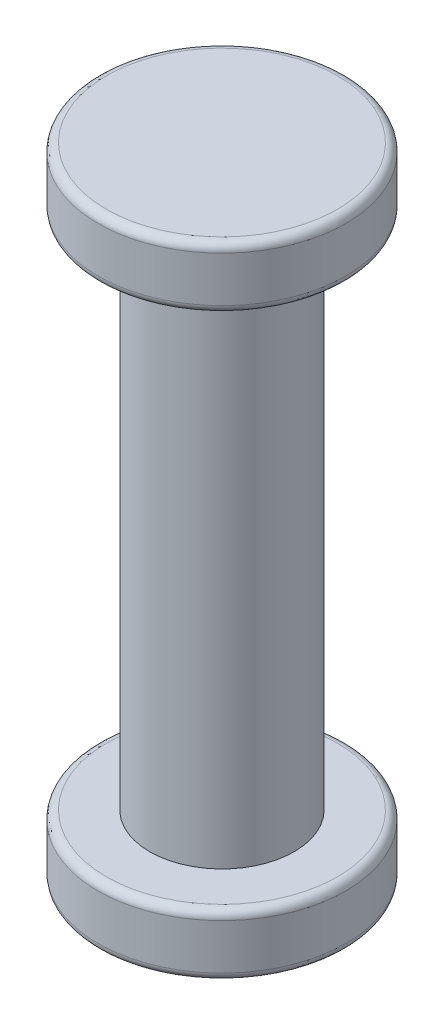
from build123d import *

# Parameters (mm, degrees)
SKETCH1_R           = 1.75
BOSS_EXTRUDE1_DEPTH = 6.25


with BuildPart() as part:
    # Sketch1 → Boss-Extrude1 (new, symmetric)
    with BuildSketch(Plane(origin=(0, 0, 0), x_dir=(1, 0, 0), z_dir=(0, 1, 0))):
        with Locations(Location((0, 0, 0), (0, 0, 270))):
            Circle(SKETCH1_R)
    extrude(amount=BOSS_EXTRUDE1_DEPTH, both=True)

    # Sketch2 → Revolve1 (revolve)
    with BuildSketch(Plane.XY, mode=Mode.PRIVATE) as revolve1_sk:
        with BuildLine():
            Line((-2.8, 6.25), (0, 6.25))
            Line((0, 6.25), (0, 7.75))
            Line((0, 7.75), (-2.8, 7.75))
            ThreePointArc((-2.8, 7.75), (-2.941421356, 7.691421356), (-3, 7.55))
            Line((-3, 7.55), (-3, 6.45))
            ThreePointArc((-3, 6.45), (-2.941421356, 6.308578644), (-2.8, 6.25))
        make_face()
        with BuildLine():
            Line((-2.8, -7.75), (0, -7.75))
            Line((0, -7.75), (0, -6.25))
            Line((0, -6.25), (-2.8, -6.25))
            ThreePointArc((-2.8, -6.25), (-2.941421356, -6.308578644), (-3, -6.45))
            Line((-3, -6.45), (-3, -7.55))
            ThreePointArc((-3, -7.55), (-2.941421356, -7.691421356), (-2.8, -7.75))
        make_face()
    revolve(revolve1_sk.sketch.rotate(Axis((0, -7.75, 0), (0, 1, 0)), 270), axis=Axis((0, -7.75, 0), (0, 1, 0)))


solid = part.part
